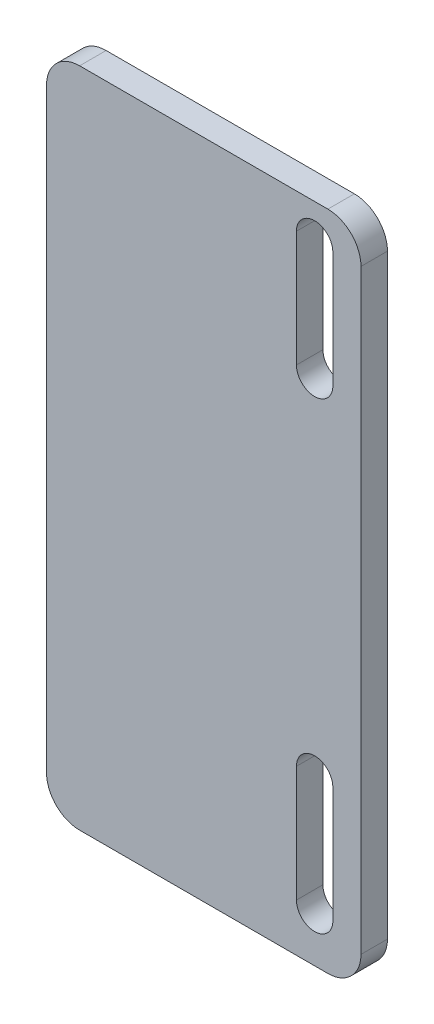
from build123d import *

# Parameters (mm, degrees)
SKETCH_1_W          = 19
SKETCH_1_H          = 40
EXTRUDE_1_DEPTH     = 1.6
FILLET_1_R          = 2
CUT_EXTRUDE_1_DEPTH = 45.312075104


with BuildPart() as part:
    # Эскиз1 → Бобышка-Вытянуть1 (new body)
    with BuildSketch(Plane.XY):
        with Locations((9.5, 20)):
            Rectangle(SKETCH_1_W, SKETCH_1_H)
    extrude(amount=EXTRUDE_1_DEPTH)

    # Скругление1
    fillet_1_edges = [part.edges().sort_by_distance(p)[0] for p in [
        (0, 40, 0.8),
        (19, 40, 0.8),
        (19, 0, 0.8),
        (0, 0, 0.8),
    ]]
    fillet(fillet_1_edges, radius=FILLET_1_R)

    # Эскиз3 → Вырез-Вытянуть1 (cut, through all)
    with BuildSketch(Plane.XY.offset(1.6)):
        with BuildLine():
            Line((15.1, 2.893381891), (15.1, 9.893381891))
            ThreePointArc((15.1, 9.893381891), (16.2, 10.993381891), (17.3, 9.893381891))
            Line((17.3, 9.893381891), (17.3, 2.893381891))
            ThreePointArc((17.3, 2.893381891), (16.2, 1.793381891), (15.1, 2.893381891))
        make_face()
        with BuildLine():
            Line((15.1, 30.893381891), (15.1, 37.893381891))
            ThreePointArc((15.1, 37.893381891), (16.2, 38.993381891), (17.3, 37.893381891))
            Line((17.3, 37.893381891), (17.3, 30.893381891))
            ThreePointArc((17.3, 30.893381891), (16.2, 29.793381891), (15.1, 30.893381891))
        make_face()
    extrude(amount=-CUT_EXTRUDE_1_DEPTH, mode=Mode.SUBTRACT)


solid = part.part
